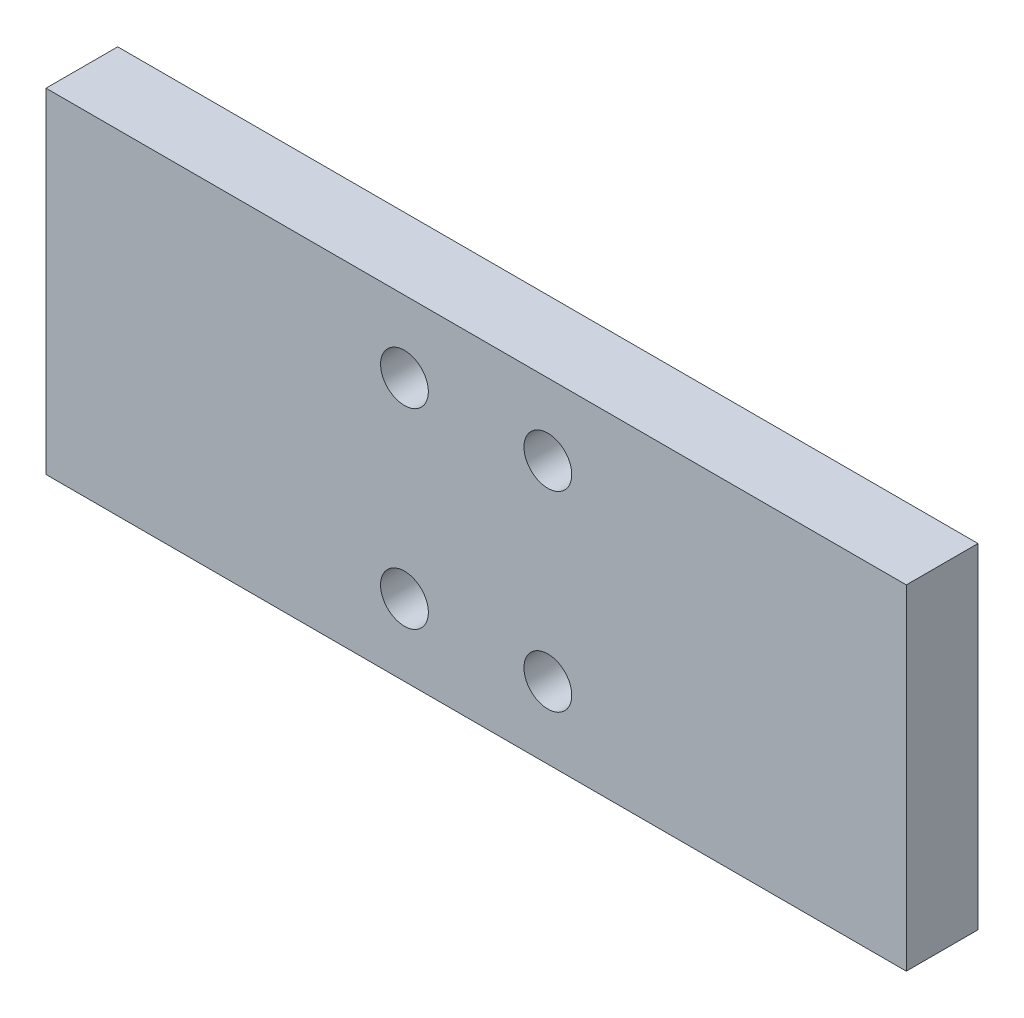
from build123d import *

# Parameters (mm, degrees)
SKETCH_1_W      = 180
SKETCH_1_H      = 70
SKETCH_1_R      = 5
EXTRUDE_1_DEPTH = 7.5


with BuildPart() as part:
    # 草图1 → 凸台-拉伸1 (new, symmetric)
    with BuildSketch(Plane.XY):
        Rectangle(SKETCH_1_W, SKETCH_1_H)
        with Locations((-15, 20)):
            Circle(SKETCH_1_R, mode=Mode.SUBTRACT)
        with Locations(Location((15, 20, 0), (0, 0, 180))):
            Circle(SKETCH_1_R, mode=Mode.SUBTRACT)
        with Locations((15, -20)):
            Circle(SKETCH_1_R, mode=Mode.SUBTRACT)
        with Locations(Location((-15, -20, 0), (0, 0, 180))):
            Circle(SKETCH_1_R, mode=Mode.SUBTRACT)
    extrude(amount=EXTRUDE_1_DEPTH, both=True)


solid = part.part
